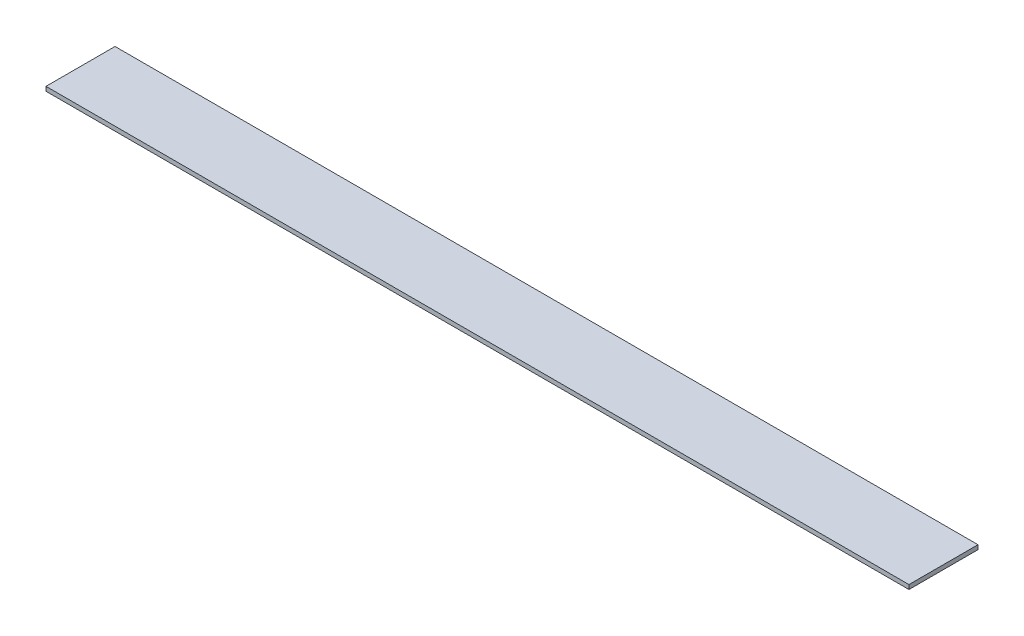
from build123d import *

# Parameters (mm, degrees)
SKETCH1_W           = 317.5
SKETCH1_H           = 25.4
BOSS_EXTRUDE1_DEPTH = 1.5875


with BuildPart() as part:
    # Sketch1 → Boss-Extrude1 (new body)
    with BuildSketch(Plane(origin=(0, 0, 0), x_dir=(1, 0, 0), z_dir=(0, 1, 0))):
        with Locations((158.75, 12.7)):
            Rectangle(SKETCH1_W, SKETCH1_H)
    extrude(amount=BOSS_EXTRUDE1_DEPTH)


solid = part.part
